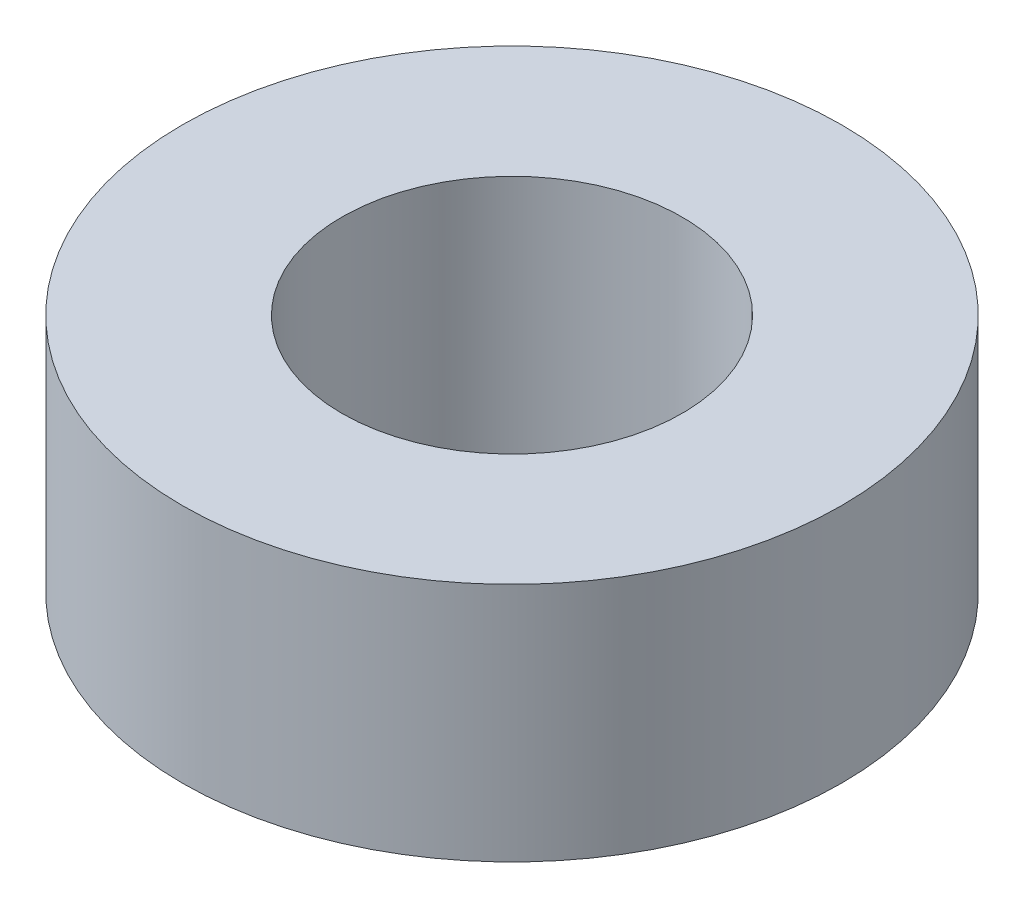
from build123d import *

# Parameters (mm, degrees)
SKETCH1_R           = 6.35
SKETCH1_R_2         = 3.2766
BOSS_EXTRUDE1_DEPTH = 4.63042


with BuildPart() as part:
    # Sketch1 → Boss-Extrude1 (new body)
    with BuildSketch(Plane(origin=(0, 0, 0), x_dir=(1, 0, 0), z_dir=(0, 1, 0))):
        Circle(SKETCH1_R)
        Circle(SKETCH1_R_2, mode=Mode.SUBTRACT)
    extrude(amount=BOSS_EXTRUDE1_DEPTH)


solid = part.part
